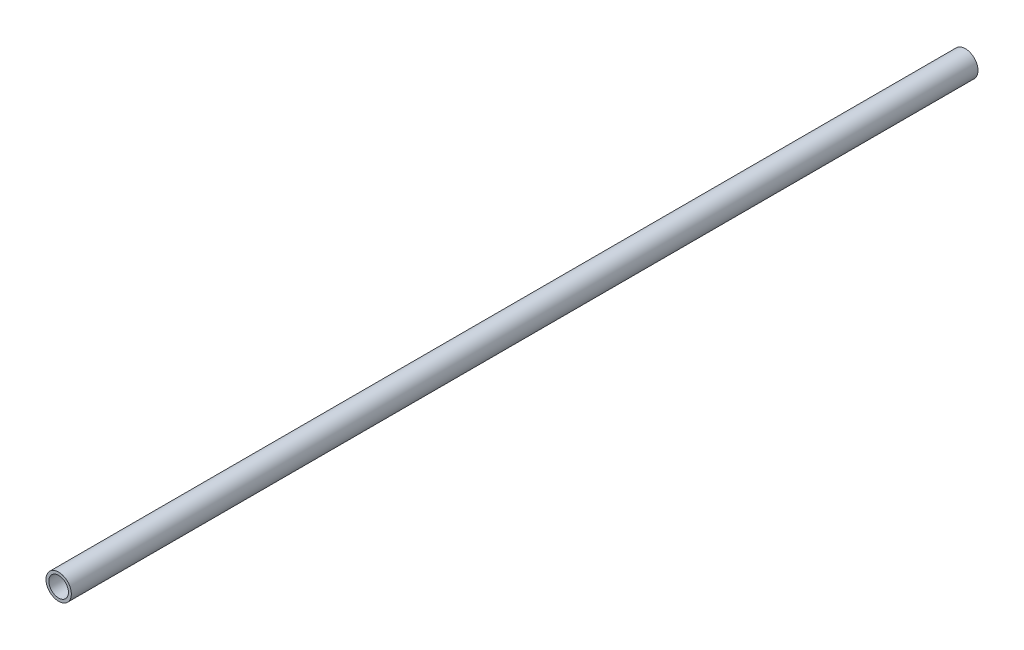
from build123d import *

# Parameters (mm, degrees)
SKETCH2_R           = 4.7625
SKETCH2_R_2         = 3.683
BOSS_EXTRUDE1_DEPTH = 170.3094511


with BuildPart() as part:
    # Sketch2 → Boss-Extrude1 (new, symmetric)
    with BuildSketch(Plane.XY):
        Circle(SKETCH2_R)
        Circle(SKETCH2_R_2, mode=Mode.SUBTRACT)
    extrude(amount=BOSS_EXTRUDE1_DEPTH, both=True)


solid = part.part
